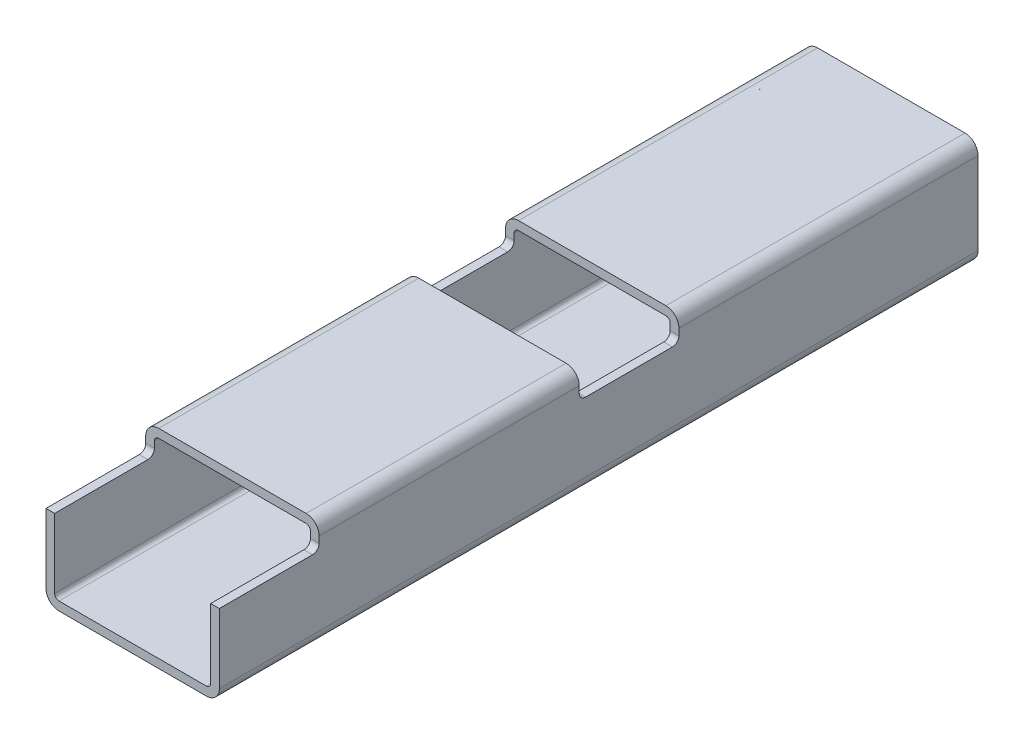
from build123d import *

# Parameters (mm, degrees)
EXTRUDE_1_DEPTH     = 350
CUT_EXTRUDE_1_DEPTH = 360.895818259


with BuildPart() as part:
    # Эскиз1 → Бобышка-Вытянуть1 (new body)
    with BuildSketch(Plane.XY):
        with BuildLine():
            Line((-34, -25), (34, -25))
            ThreePointArc((34, -25), (38.242640687, -23.242640687), (40, -19))
            Line((40, -19), (40, 19))
            ThreePointArc((40, 19), (38.242640687, 23.242640687), (34, 25))
            Line((34, 25), (-34, 25))
            ThreePointArc((-34, 25), (-38.242640687, 23.242640687), (-40, 19))
            Line((-40, 19), (-40, -19))
            ThreePointArc((-40, -19), (-38.242640687, -23.242640687), (-34, -25))
        make_face()
        with BuildLine():
            Line((-34, -21), (34, -21))
            ThreePointArc((34, -21), (35.414213562, -20.414213562), (36, -19))
            Line((36, -19), (36, 19))
            ThreePointArc((36, 19), (35.414213562, 20.414213562), (34, 21))
            Line((34, 21), (-34, 21))
            ThreePointArc((-34, 21), (-35.414213562, 20.414213562), (-36, 19))
            Line((-36, 19), (-36, -19))
            ThreePointArc((-36, -19), (-35.414213562, -20.414213562), (-34, -21))
        make_face(mode=Mode.SUBTRACT)
    extrude(amount=EXTRUDE_1_DEPTH)

    # Эскиз2 → Вырез-Вытянуть1 (cut, through all)
    with BuildSketch(Plane(origin=(40, 0, 0), x_dir=(0, 0, -1), z_dir=(1, 0, 0))):
        with BuildLine():
            Line((-350, 13), (-307, 13))
            ThreePointArc((-307, 13), (-304.878679656, 13.878679656), (-304, 16))
            Line((-304, 16), (-304, 25))
            Line((-304, 25), (-350, 25))
            Line((-350, 25), (-350, 13))
        make_face()
        with BuildLine():
            Line((-181, 13), (-141, 13))
            ThreePointArc((-141, 13), (-138.878679656, 13.878679656), (-138, 16))
            Line((-138, 16), (-138, 25))
            Line((-138, 25), (-184, 25))
            Line((-184, 25), (-184, 16))
            ThreePointArc((-184, 16), (-183.121320344, 13.878679656), (-181, 13))
        make_face()
    extrude(amount=-CUT_EXTRUDE_1_DEPTH, mode=Mode.SUBTRACT)


solid = part.part
